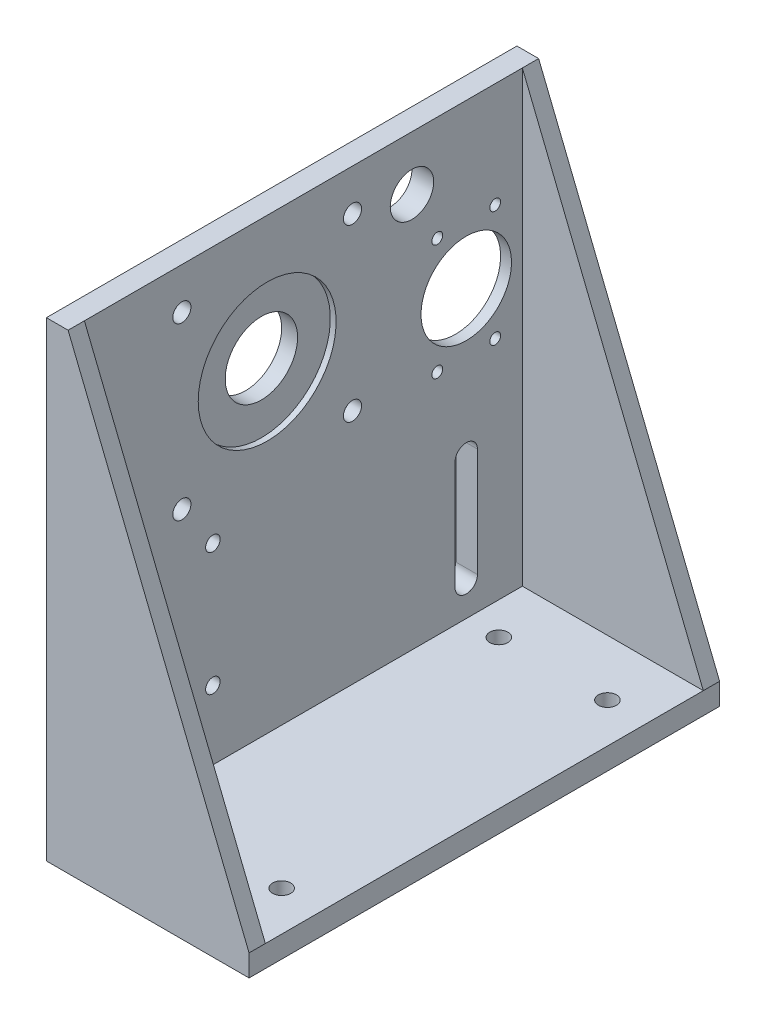
from build123d import *

# Parameters (mm, degrees)
SKETCH1_W                  = 130
SKETCH1_H                  = 130
BOSS_EXTRUDE1_DEPTH        = 6
SKETCH2_W                  = 130
SKETCH2_H                  = 6
BOSS_EXTRUDE2_DEPTH        = 50
BOSS_EXTRUDE3_DEPTH        = 4.5
BOSS_EXTRUDE4_DEPTH        = 4.5
SKETCH5_R                  = 19.05
CUT_EXTRUDE1_DEPTH         = 1.6
SKETCH6_R                  = 10
CUT_EXTRUDE2_DEPTH         = 191.951721647
SKETCH7_R                  = 2.5
CUT_EXTRUDE3_DEPTH         = 193.187408537
SKETCH8_R                  = 12.5
SKETCH8_R_2                = 1.5
ENCODER_MOUNTING_DEPTH     = 193.187408537
SKETCH9_W                  = 35
SKETCH9_H                  = 38
SQR_SLOT_FRO_ENCODER_DEPTH = 3
SKETCH10_R                 = 6
CUT_EXTRUDE6_DEPTH         = 193.187408537
SKETCH12_R                 = 2
CUT_EXTRUDE8_DEPTH         = 193.187408537
CHAMFER1_SIZE              = 2.5
SKETCH14_R                 = 2.5
CUT_EXTRUDE10_DEPTH        = 193.187408537
CUT_EXTRUDE11_DEPTH        = 193.187408537


with BuildPart() as part:
    # Sketch1 → Boss-Extrude1 (new body)
    with BuildSketch(Plane(origin=(0, 0, 0), x_dir=(0, 0, -1), z_dir=(1, 0, 0))):
        with Locations((65, 65)):
            Rectangle(SKETCH1_W, SKETCH1_H)
    extrude(amount=BOSS_EXTRUDE1_DEPTH)

    # Sketch2 → Boss-Extrude2 (add)
    with BuildSketch(Plane(origin=(6, 0, 0), x_dir=(0, 0, -1), z_dir=(1, 0, 0))):
        with Locations((65, 3)):
            Rectangle(SKETCH2_W, SKETCH2_H)
    extrude(amount=BOSS_EXTRUDE2_DEPTH)

    # Sketch3 → Boss-Extrude3 (add)
    with BuildSketch(Plane(origin=(0, 0, -130), x_dir=(-1, 0, 0), z_dir=(0, 0, -1))):
        Polygon((-6, 130), (-56, 6), (-6, 6), align=None)
    extrude(amount=-BOSS_EXTRUDE3_DEPTH)

    # Sketch4 → Boss-Extrude4 (add)
    with BuildSketch(Plane.XY):
        Polygon((6, 130), (56, 6), (6, 6), align=None)
    extrude(amount=-BOSS_EXTRUDE4_DEPTH)

    # Sketch5 → Cut-Extrude1 (cut)
    with BuildSketch(Plane.ZY.offset(-6)):
        with Locations((-55, 95)):
            Circle(SKETCH5_R)
    extrude(amount=CUT_EXTRUDE1_DEPTH, mode=Mode.SUBTRACT)

    # Sketch6 → Cut-Extrude2 (cut, through all)
    with BuildSketch(Plane(origin=(4.4, 0, 0), x_dir=(0, 0, -1), z_dir=(1, 0, 0))):
        with Locations((55, 95)):
            Circle(SKETCH6_R)
    extrude(amount=-CUT_EXTRUDE2_DEPTH, mode=Mode.SUBTRACT)

    # Sketch7 → Cut-Extrude3 (cut, through all)
    with BuildSketch(Plane.ZY):
        with Locations((-78.57, 118.57)):
            Circle(SKETCH7_R)
        with Locations((-31.43, 118.57)):
            Circle(SKETCH7_R)
        with Locations((-31.43, 71.43)):
            Circle(SKETCH7_R)
        with Locations((-78.57, 71.43)):
            Circle(SKETCH7_R)
    extrude(amount=-CUT_EXTRUDE3_DEPTH, mode=Mode.SUBTRACT)

    # Sketch8 → Encoder mounting (cut, through all)
    with BuildSketch(Plane.ZY):
        with Locations((-110, 85)):
            Circle(SKETCH8_R)
        with Locations((-118, 101)):
            Circle(SKETCH8_R_2)
        with Locations((-102, 101)):
            Circle(SKETCH8_R_2)
        with Locations((-102, 69)):
            Circle(SKETCH8_R_2)
        with Locations((-118, 69)):
            Circle(SKETCH8_R_2)
    extrude(amount=-ENCODER_MOUNTING_DEPTH, mode=Mode.SUBTRACT)

    # Sketch9 → Sqr Slot fro encoder (cut)
    with BuildSketch(Plane.ZY):
        with Locations((-112.5, 85)):
            Rectangle(SKETCH9_W, SKETCH9_H)
    extrude(amount=-SQR_SLOT_FRO_ENCODER_DEPTH, mode=Mode.SUBTRACT)

    # Sketch10 → Cut-Extrude6 (cut, through all)
    with BuildSketch(Plane.ZY):
        with Locations((-95, 115)):
            Circle(SKETCH10_R)
    extrude(amount=-CUT_EXTRUDE6_DEPTH, mode=Mode.SUBTRACT)

    # Sketch12 → Cut-Extrude8 (cut, through all)
    with BuildSketch(Plane.ZY):
        with Locations((-10, 25)):
            Circle(SKETCH12_R)
        with Locations((-10, 59)):
            Circle(SKETCH12_R)
        with Locations((-40, 59)):
            Circle(SKETCH12_R)
        with Locations((-40, 25)):
            Circle(SKETCH12_R)
    extrude(amount=-CUT_EXTRUDE8_DEPTH, mode=Mode.SUBTRACT)

    # Chamfer1
    chamfer1_edges = [part.edges().sort_by_distance(p)[0] for p in [
        (0, 118.57, -81.07),
        (0, 118.57, -33.93),
        (0, 71.43, -33.93),
        (0, 71.43, -81.07),
    ]]
    chamfer(chamfer1_edges, length=CHAMFER1_SIZE)

    # Sketch14 → Cut-Extrude10 (cut, through all)
    with BuildSketch(Plane.XZ):
        with Locations(Location((15, -20, 0), (0, 0, 270))):
            Circle(SKETCH14_R)
        with Locations(Location((45, -20, 0), (0, 0, 270))):
            Circle(SKETCH14_R)
        with Locations(Location((15, -110, 0), (0, 0, 270))):
            Circle(SKETCH14_R)
        with Locations(Location((45, -110, 0), (0, 0, 270))):
            Circle(SKETCH14_R)
    extrude(amount=-CUT_EXTRUDE10_DEPTH, mode=Mode.SUBTRACT)

    # Sketch15 → Cut-Extrude11 (cut, through all)
    with BuildSketch(Plane.ZY):
        with BuildLine():
            Line((-113.1, 15), (-113.1, 45))
            ThreePointArc((-113.1, 45), (-110, 48.1), (-106.9, 45))
            Line((-106.9, 45), (-106.9, 15))
            ThreePointArc((-106.9, 15), (-110, 11.9), (-113.1, 15))
        make_face()
    extrude(amount=-CUT_EXTRUDE11_DEPTH, mode=Mode.SUBTRACT)


solid = part.part
